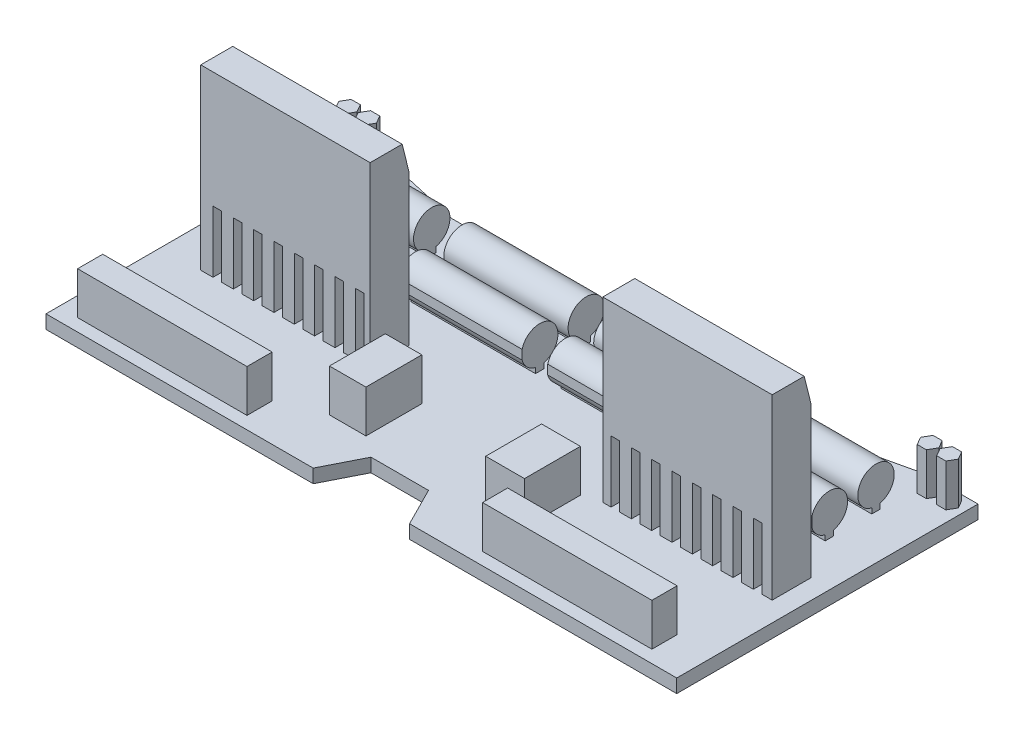
from build123d import *

# Parameters (mm, degrees)
BOSS_EXTRU_1_DEPTH                   = 1.6
ESQUISSE2_W                          = 4.713074058
ESQUISSE2_H                          = 2.154548141
ESQUISSE2_W_2                        = 5.251711093
ESQUISSE2_W_3                        = 20
ESQUISSE2_H_2                        = 4.6
ESQUISSE2_H_3                        = 2.967741935
ESQUISSE2_W_4                        = 4.309096282
ESQUISSE2_H_4                        = 6.598303681
ESQUISSE2_W_5                        = 4.578414799
ESQUISSE2_W_6                        = 13.331266621
ESQUISSE2_H_5                        = 5.251711093
ESQUISSE2_W_7                        = 15.620474021
ESQUISSE2_H_6                        = 4.309096282
ESQUISSE2_H_7                        = 4.462709732
ESQUISSE2_W_8                        = 14.677859209
ESQUISSE2_W_9                        = 14.958296381
ESQUISSE2_H_8                        = 4.982392575
BOSS_EXTRU_2_DEPTH                   = 5
ESQUISSE3_W                          = 20
ESQUISSE3_H                          = 4.6
BOSS_EXTRU_3_DEPTH                   = 16
ENL_V_MAT_EXTRU_1_DEPTH              = 77
R_P_TITION_LIN_AIRE1_COUNT           = 2
R_P_TITION_LIN_AIRE1_PITCH           = 5.5
ESQUISSE5_W                          = 1.006492892
ESQUISSE5_H                          = 7.282915477
ENL_V_MAT_EXTRU_2_DEPTH              = 5
R_P_TITION_LIN_AIRE2_COUNT           = 8
R_P_TITION_LIN_AIRE2_PITCH           = 2.4
R_P_TITION_LIN_AIRE3_COPY_1_SKETCH_W = 1.006492892
R_P_TITION_LIN_AIRE3_COPY_1_SKETCH_H = 7.282915477
R_P_TITION_LIN_AIRE3_COPY_1_DEPTH    = 5
R_P_TITION_LIN_AIRE3_COPY_2_SKETCH_W = 1.006492892
R_P_TITION_LIN_AIRE3_COPY_2_SKETCH_H = 7.282915477
R_P_TITION_LIN_AIRE3_COPY_2_DEPTH    = 5
R_P_TITION_LIN_AIRE3_COPY_3_SKETCH_W = 1.006492892
R_P_TITION_LIN_AIRE3_COPY_3_SKETCH_H = 7.282915477
R_P_TITION_LIN_AIRE3_COPY_3_DEPTH    = 5
R_P_TITION_LIN_AIRE3_COPY_4_SKETCH_W = 1.006492892
R_P_TITION_LIN_AIRE3_COPY_4_SKETCH_H = 7.282915477
R_P_TITION_LIN_AIRE3_COPY_4_DEPTH    = 5
R_P_TITION_LIN_AIRE3_COPY_5_SKETCH_W = 1.006492892
R_P_TITION_LIN_AIRE3_COPY_5_SKETCH_H = 7.282915477
R_P_TITION_LIN_AIRE3_COPY_5_DEPTH    = 5
R_P_TITION_LIN_AIRE3_COPY_6_SKETCH_W = 1.006492892
R_P_TITION_LIN_AIRE3_COPY_6_SKETCH_H = 7.282915477
R_P_TITION_LIN_AIRE3_COPY_6_DEPTH    = 5
R_P_TITION_LIN_AIRE3_COPY_7_SKETCH_W = 1.006492892
R_P_TITION_LIN_AIRE3_COPY_7_SKETCH_H = 7.282915477
R_P_TITION_LIN_AIRE3_COPY_7_DEPTH    = 5
R_P_TITION_LIN_AIRE3_COPY_8_SKETCH_W = 1.006492892
R_P_TITION_LIN_AIRE3_COPY_8_SKETCH_H = 7.282915477
R_P_TITION_LIN_AIRE3_COPY_8_DEPTH    = 5
ESQUISSE6_W                          = 5.251711093
ESQUISSE6_H                          = 2.154548141
ENL_V_MAT_EXTRU_3_DEPTH              = 5
R_P_TITION_LIN_AIRE4_COUNT           = 2
R_P_TITION_LIN_AIRE4_PITCH           = 68.7
ENL_V_MAT_EXTRU_4_DEPTH              = 70


with BuildPart() as part:
    # Esquisse1 → Boss.-Extru.1 (new body)
    with BuildSketch(Plane(origin=(0, 0, 0), x_dir=(1, 0, 0), z_dir=(0, 1, 0))):
        Polygon((-55.638689672, 29.727388548), (-49.638689672, 29.727388548), (-41.402574305, 27.857388548), (-20.802574305, 27.857388548), (-19.902574526, 30.855331272), (-16.902574526, 30.855331272), (-16.002574746, 27.855331272), (4.597425254, 27.855331272), (12.829463431, 29.725331272), (18.829463431, 29.725331272), (18.829463431, -5.844668728), (-12.720536569, -5.844668728), (-15.003734401, -1.314668728), (-21.801414651, -1.314668728), (-24.088689672, -5.842611452), (-55.638689672, -5.842611452), align=None)
    extrude(amount=BOSS_EXTRU_1_DEPTH)

    # Esquisse2 → Boss.-Extru.2 (add)
    with BuildSketch(Plane(origin=(0, 1.6, 0), x_dir=(1, 0, 0), z_dir=(0, 1, 0))):
        with Locations((-52.877383373, 28.159470108)):
            Rectangle(ESQUISSE2_W, ESQUISSE2_H)
        with Locations((15.866168244, 28.159470108)):
            Rectangle(ESQUISSE2_W_2, ESQUISSE2_H)
        with Locations((-40.960038969, 10.047799799)):
            Rectangle(ESQUISSE2_W_3, ESQUISSE2_H_2)
        with Locations((6.507349757, 10.047799799)):
            Rectangle(ESQUISSE2_W_3, ESQUISSE2_H_2)
        with Locations((-43.383905627, -2.882108167)):
            Rectangle(ESQUISSE2_W_3, ESQUISSE2_H_3)
        with Locations((4.422545985, -2.882108167)):
            Rectangle(ESQUISSE2_W_3, ESQUISSE2_H_3)
        with Locations((-26.416839019, 3.853473895)):
            Rectangle(ESQUISSE2_W_4, ESQUISSE2_H_4)
        with Locations((-7.833861305, 3.853473895)):
            Rectangle(ESQUISSE2_W_5, ESQUISSE2_H_4)
        with Locations((-45.538453769, 22.975088644)):
            Rectangle(ESQUISSE2_W_6, ESQUISSE2_H_5)
        with Locations((5.766723834, 22.975088644)):
            Rectangle(ESQUISSE2_W_7, ESQUISSE2_H_5)
        with Locations((5.766723834, 17.511911566)):
            Rectangle(ESQUISSE2_W_7, ESQUISSE2_H_6)
        with Locations((-45.538453769, 17.511911566)):
            Rectangle(ESQUISSE2_W_6, ESQUISSE2_H_7)
        with Locations((-27.965420495, 22.975088644)):
            Rectangle(ESQUISSE2_W_8, ESQUISSE2_H_5)
        with Locations((-27.965420495, 17.511911566)):
            Rectangle(ESQUISSE2_W_8, ESQUISSE2_H_6)
        with Locations((-10.123068705, 22.975088644)):
            Rectangle(ESQUISSE2_W_9, ESQUISSE2_H_8)
        with Locations((-10.123068705, 17.511911566)):
            Rectangle(ESQUISSE2_W_9, ESQUISSE2_H_6)
    extrude(amount=BOSS_EXTRU_2_DEPTH)

    # Esquisse3 → Boss.-Extru.3 (add)
    with BuildSketch(Plane(origin=(0, 6.6, 0), x_dir=(1, 0, 0), z_dir=(0, 1, 0))):
        with Locations((-40.960038969, 10.047799799)):
            Rectangle(ESQUISSE3_W, ESQUISSE3_H)
        with Locations((6.507349757, 10.047799799)):
            Rectangle(ESQUISSE3_W, ESQUISSE3_H)
    extrude(amount=BOSS_EXTRU_3_DEPTH)

    # Esquisse4 → Enlèv. mat.-Extru.1 (cut)
    with BuildSketch(Plane.ZY.offset(52.204087079)):
        with BuildLine():
            Line((-23.434993616, 1.6), (-23.434993616, 2.228004138))
            ThreePointArc((-23.434993616, 2.228004138), (-24.266815676, 6.006880547), (-20.784993616, 4.319056504))
            ThreePointArc((-20.784993616, 4.319056504), (-21.247169573, 2.987234444), (-22.434993616, 2.228004138))
            Line((-22.434993616, 2.228004138), (-22.434993616, 1.6))
            Line((-22.434993616, 1.6), (-20.349233097, 1.6))
            Line((-20.349233097, 1.6), (-20.349233097, 6.6))
            Line((-20.349233097, 6.6), (-25.60094419, 6.6))
            Line((-25.60094419, 6.6), (-25.60094419, 1.6))
            Line((-25.60094419, 1.6), (-23.434993616, 1.6))
        make_face()
    enl_v_mat_extru_1 = extrude(amount=-ENL_V_MAT_EXTRU_1_DEPTH, mode=Mode.SUBTRACT)

    # Répétition linéaire1: Enlèv. mat.-Extru.1 ×2
    with Locations(*[(0, 0, i * R_P_TITION_LIN_AIRE1_PITCH) for i in range(1, R_P_TITION_LIN_AIRE1_COUNT)]):
        add(enl_v_mat_extru_1, mode=Mode.SUBTRACT)

    # Esquisse5 → Enlèv. mat.-Extru.2 (cut)
    with BuildSketch(Plane(origin=(0, 0, -12.347799799), x_dir=(-1, 0, 0), z_dir=(0, 0, -1))):
        with Locations((-14.78767096, 5.241457739)):
            Rectangle(ESQUISSE5_W, ESQUISSE5_H)
    enl_v_mat_extru_2 = extrude(amount=-ENL_V_MAT_EXTRU_2_DEPTH, mode=Mode.SUBTRACT)

    # Répétition linéaire2: Enlèv. mat.-Extru.2 ×8
    with Locations(*[(-i * R_P_TITION_LIN_AIRE2_PITCH, 0, 0) for i in range(1, R_P_TITION_LIN_AIRE2_COUNT)]):
        add(enl_v_mat_extru_2, mode=Mode.SUBTRACT)

    # Répétition linéaire3 copy 1 sketch → Répétition linéaire3 copy 1 (cut)
    with BuildSketch(Plane(origin=(-49.4, 0, -12.347799799), x_dir=(-1, 0, 0), z_dir=(0, 0, -1))):
        with Locations((-14.78767096, 5.241457739)):
            Rectangle(R_P_TITION_LIN_AIRE3_COPY_1_SKETCH_W, R_P_TITION_LIN_AIRE3_COPY_1_SKETCH_H)
    extrude(amount=-R_P_TITION_LIN_AIRE3_COPY_1_DEPTH, mode=Mode.SUBTRACT)

    # Répétition linéaire3 copy 2 sketch → Répétition linéaire3 copy 2 (cut)
    with BuildSketch(Plane(origin=(-51.8, 0, -12.347799799), x_dir=(-1, 0, 0), z_dir=(0, 0, -1))):
        with Locations((-14.78767096, 5.241457739)):
            Rectangle(R_P_TITION_LIN_AIRE3_COPY_2_SKETCH_W, R_P_TITION_LIN_AIRE3_COPY_2_SKETCH_H)
    extrude(amount=-R_P_TITION_LIN_AIRE3_COPY_2_DEPTH, mode=Mode.SUBTRACT)

    # Répétition linéaire3 copy 3 sketch → Répétition linéaire3 copy 3 (cut)
    with BuildSketch(Plane(origin=(-54.2, 0, -12.347799799), x_dir=(-1, 0, 0), z_dir=(0, 0, -1))):
        with Locations((-14.78767096, 5.241457739)):
            Rectangle(R_P_TITION_LIN_AIRE3_COPY_3_SKETCH_W, R_P_TITION_LIN_AIRE3_COPY_3_SKETCH_H)
    extrude(amount=-R_P_TITION_LIN_AIRE3_COPY_3_DEPTH, mode=Mode.SUBTRACT)

    # Répétition linéaire3 copy 4 sketch → Répétition linéaire3 copy 4 (cut)
    with BuildSketch(Plane(origin=(-56.6, 0, -12.347799799), x_dir=(-1, 0, 0), z_dir=(0, 0, -1))):
        with Locations((-14.78767096, 5.241457739)):
            Rectangle(R_P_TITION_LIN_AIRE3_COPY_4_SKETCH_W, R_P_TITION_LIN_AIRE3_COPY_4_SKETCH_H)
    extrude(amount=-R_P_TITION_LIN_AIRE3_COPY_4_DEPTH, mode=Mode.SUBTRACT)

    # Répétition linéaire3 copy 5 sketch → Répétition linéaire3 copy 5 (cut)
    with BuildSketch(Plane(origin=(-59, 0, -12.347799799), x_dir=(-1, 0, 0), z_dir=(0, 0, -1))):
        with Locations((-14.78767096, 5.241457739)):
            Rectangle(R_P_TITION_LIN_AIRE3_COPY_5_SKETCH_W, R_P_TITION_LIN_AIRE3_COPY_5_SKETCH_H)
    extrude(amount=-R_P_TITION_LIN_AIRE3_COPY_5_DEPTH, mode=Mode.SUBTRACT)

    # Répétition linéaire3 copy 6 sketch → Répétition linéaire3 copy 6 (cut)
    with BuildSketch(Plane(origin=(-61.4, 0, -12.347799799), x_dir=(-1, 0, 0), z_dir=(0, 0, -1))):
        with Locations((-14.78767096, 5.241457739)):
            Rectangle(R_P_TITION_LIN_AIRE3_COPY_6_SKETCH_W, R_P_TITION_LIN_AIRE3_COPY_6_SKETCH_H)
    extrude(amount=-R_P_TITION_LIN_AIRE3_COPY_6_DEPTH, mode=Mode.SUBTRACT)

    # Répétition linéaire3 copy 7 sketch → Répétition linéaire3 copy 7 (cut)
    with BuildSketch(Plane(origin=(-63.8, 0, -12.347799799), x_dir=(-1, 0, 0), z_dir=(0, 0, -1))):
        with Locations((-14.78767096, 5.241457739)):
            Rectangle(R_P_TITION_LIN_AIRE3_COPY_7_SKETCH_W, R_P_TITION_LIN_AIRE3_COPY_7_SKETCH_H)
    extrude(amount=-R_P_TITION_LIN_AIRE3_COPY_7_DEPTH, mode=Mode.SUBTRACT)

    # Répétition linéaire3 copy 8 sketch → Répétition linéaire3 copy 8 (cut)
    with BuildSketch(Plane(origin=(-47, 0, -12.347799799), x_dir=(-1, 0, 0), z_dir=(0, 0, -1))):
        with Locations((-14.78767096, 5.241457739)):
            Rectangle(R_P_TITION_LIN_AIRE3_COPY_8_SKETCH_W, R_P_TITION_LIN_AIRE3_COPY_8_SKETCH_H)
    extrude(amount=-R_P_TITION_LIN_AIRE3_COPY_8_DEPTH, mode=Mode.SUBTRACT)

    # Esquisse6 → Enlèv. mat.-Extru.3 (cut)
    with BuildSketch(Plane(origin=(0, 6.6, 0), x_dir=(1, 0, 0), z_dir=(0, 1, 0))):
        with Locations((15.866168244, 28.159470108)):
            Rectangle(ESQUISSE6_W, ESQUISSE6_H)
        Polygon((14.154024579, 27.226319822), (13.615270011, 28.159470107), (14.154024579, 29.092620392), (15.231533716, 29.092620392), (15.770288284, 28.159470107), (15.231533716, 27.226319822), align=None, mode=Mode.SUBTRACT)
        Polygon((16.454024579, 27.226319822), (15.915270011, 28.159470107), (16.454024579, 29.092620392), (17.531533716, 29.092620392), (18.070288284, 28.159470107), (17.531533716, 27.226319822), align=None, mode=Mode.SUBTRACT)
    enl_v_mat_extru_3 = extrude(amount=-ENL_V_MAT_EXTRU_3_DEPTH, mode=Mode.SUBTRACT)

    # Répétition linéaire4: Enlèv. mat.-Extru.3 ×2
    with Locations(*[(-i * R_P_TITION_LIN_AIRE4_PITCH, 0, 0) for i in range(1, R_P_TITION_LIN_AIRE4_COUNT)]):
        add(enl_v_mat_extru_3, mode=Mode.SUBTRACT)

    # Esquisse7 → Enlèv. mat.-Extru.4 (cut)
    with BuildSketch(Plane(origin=(16.507349757, 0, 0), x_dir=(0, 0, -1), z_dir=(1, 0, 0))):
        Polygon((12.347799799, 22.6), (12.347799799, 19.316818729), (11.527871154, 22.6), align=None)
    extrude(amount=-ENL_V_MAT_EXTRU_4_DEPTH, mode=Mode.SUBTRACT)


solid = part.part
